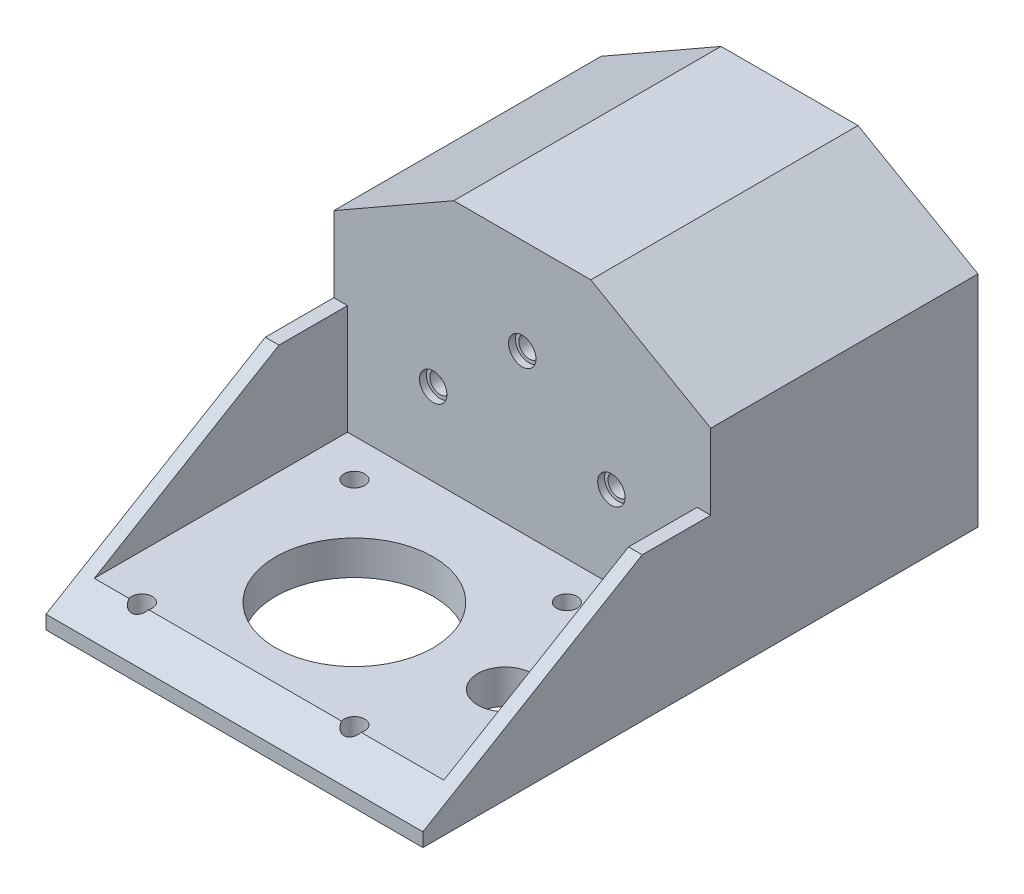
from build123d import *

# Parameters (mm, degrees)
BOSS_EXTRUDE1_DEPTH = 39
SKETCH2_W           = 55
SKETCH2_H           = 5
BOSS_EXTRUDE2_DEPTH = 42
SKETCH3_R           = 11.5
SKETCH3_R_2         = 1.5
SKETCH3_R_3         = 4
CUT_EXTRUDE1_DEPTH  = 105.66613588
SKETCH4_R           = 1.5
CUT_EXTRUDE2_DEPTH  = 81.950602221
SKETCH5_R           = 2
CUT_EXTRUDE3_DEPTH  = 1
SKETCH6_W           = 2
SKETCH6_H           = 42
BOSS_EXTRUDE3_DEPTH = 16
CUT_EXTRUDE4_DEPTH  = 100


with BuildPart() as part:
    # Sketch1 → Boss-Extrude1 (new body)
    with BuildSketch(Plane.XY):
        Polygon((0, 0), (55, 0), (55, 32), (37.5, 42), (17.5, 42), (0, 32), align=None)
    extrude(amount=BOSS_EXTRUDE1_DEPTH)

    # Sketch2 → Boss-Extrude2 (add)
    with BuildSketch(Plane.XY.offset(39)):
        with Locations((27.5, 2.5)):
            Rectangle(SKETCH2_W, SKETCH2_H)
    extrude(amount=BOSS_EXTRUDE2_DEPTH)

    # Sketch3 → Cut-Extrude1 (cut, through all)
    with BuildSketch(Plane(origin=(0, 5, 0), x_dir=(1, 0, 0), z_dir=(0, 1, 0))):
        with Locations(Location((24, -60, 0), (0, 0, 180))):
            Circle(SKETCH3_R)
        with Locations(Location((8.5, -44.5, 0), (0, 0, 180))):
            Circle(SKETCH3_R_2)
        with Locations(Location((39.5, -44.5, 0), (0, 0, 180))):
            Circle(SKETCH3_R_2)
        with Locations(Location((39.5, -75.5, 0), (0, 0, 180))):
            Circle(SKETCH3_R_2)
        with Locations(Location((8.5, -75.5, 0), (0, 0, 180))):
            Circle(SKETCH3_R_2)
        with Locations(Location((46, -60, 0), (0, 0, 180))):
            Circle(SKETCH3_R_3)
    extrude(amount=-CUT_EXTRUDE1_DEPTH, mode=Mode.SUBTRACT)

    # Sketch4 → Cut-Extrude2 (cut, through all)
    with BuildSketch(Plane.XY.offset(39)):
        with Locations((27.5, 28)):
            Circle(SKETCH4_R)
        with Locations((40.5, 17)):
            Circle(SKETCH4_R)
        with Locations(Location((14.5, 17, 0), (0, 0, 180))):
            Circle(SKETCH4_R)
    extrude(amount=-CUT_EXTRUDE2_DEPTH, mode=Mode.SUBTRACT)

    # Sketch5 → Cut-Extrude3 (cut)
    with BuildSketch(Plane.XY.offset(39)):
        with Locations((27.5, 28)):
            Circle(SKETCH5_R)
        with Locations((40.5, 17)):
            Circle(SKETCH5_R)
        with Locations((14.5, 17)):
            Circle(SKETCH5_R)
    extrude(amount=-CUT_EXTRUDE3_DEPTH, mode=Mode.SUBTRACT)

    # Sketch6 → Boss-Extrude3 (add)
    with BuildSketch(Plane(origin=(0, 5, 0), x_dir=(1, 0, 0), z_dir=(0, 1, 0))):
        with Locations((1, -60)):
            Rectangle(SKETCH6_W, SKETCH6_H)
        with Locations((54, -60)):
            Rectangle(SKETCH6_W, SKETCH6_H)
    extrude(amount=BOSS_EXTRUDE3_DEPTH)

    # Sketch7 → Cut-Extrude4 (cut)
    with BuildSketch(Plane(origin=(55, 0, 0), x_dir=(0, 0, -1), z_dir=(1, 0, 0))):
        Polygon((-49, 21), (-81, 21), (-81, 2), align=None)
    extrude(amount=-CUT_EXTRUDE4_DEPTH, mode=Mode.SUBTRACT)


solid = part.part
